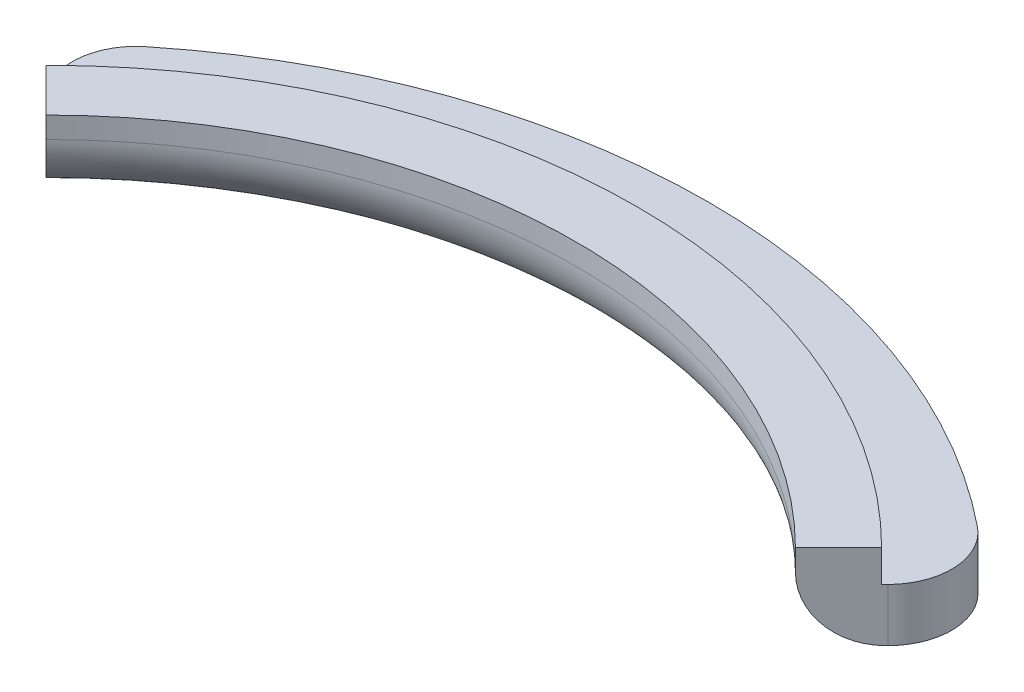
from build123d import *

# Parameters (mm, degrees)
BOSS_EXTRUDE1_DEPTH = 2.032
CUT_EXTRUDE1_START  = -0.762
CUT_EXTRUDE1_DEPTH  = 0.762
FILLET2_R           = 1.524
FILLET1_R           = 1.524


with BuildPart() as part:
    # Sketch1 → Boss-Extrude1 (new body)
    with BuildSketch(Plane(origin=(0, 0, 0), x_dir=(1, 0, 0), z_dir=(0, 1, 0))):
        with BuildLine():
            Line((-8.980256121, 8.980256121), (-11.225320151, 11.225320151))
            ThreePointArc((-11.225320151, 11.225320151), (0, 15.875), (11.225320151, 11.225320151))
            Line((11.225320151, 11.225320151), (8.980256121, 8.980256121))
            ThreePointArc((8.980256121, 8.980256121), (0, 12.7), (-8.980256121, 8.980256121))
        make_face()
    extrude(amount=BOSS_EXTRUDE1_DEPTH)

    # Sketch2 → Cut-Extrude1 (cut)
    with BuildSketch(Plane(origin=(0, 2.032, 0), x_dir=(1, 0, 0), z_dir=(0, 1, 0)).offset(CUT_EXTRUDE1_START)):
        with BuildLine():
            Line((10.012985575, 10.012985575), (11.225320151, 11.225320151))
            ThreePointArc((11.225320151, 11.225320151), (0, 15.875), (-11.225320151, 11.225320151))
            Line((-11.225320151, 11.225320151), (-10.012985575, 10.012985575))
            ThreePointArc((-10.012985575, 10.012985575), (0, 14.1605), (10.012985575, 10.012985575))
        make_face()
    extrude(amount=CUT_EXTRUDE1_DEPTH, mode=Mode.SUBTRACT)

    # Fillet2
    fillet2_edges = [part.edges().sort_by_distance(p)[0] for p in [
        (0, 0, -12.7),
    ]]
    fillet(fillet2_edges, radius=FILLET2_R)

    # Fillet1
    fillet1_edges = [part.edges().sort_by_distance(p)[0] for p in [
        (-11.225320151, 0.635, -11.225320151),
        (11.225320151, 0.635, -11.225320151),
    ]]
    fillet(fillet1_edges, radius=FILLET1_R)


solid = part.part
